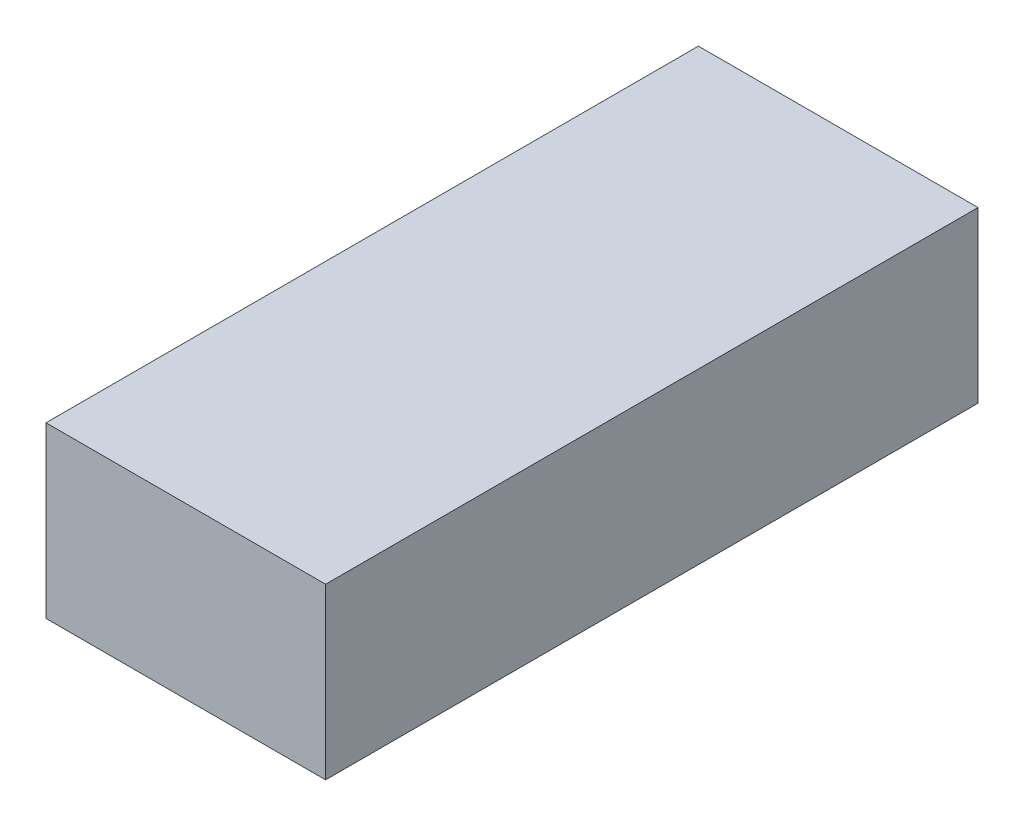
from build123d import *

# Parameters (mm, degrees)
SKETCH1_W           = 33
SKETCH1_H           = 77
BOSS_EXTRUDE1_DEPTH = 20


with BuildPart() as part:
    # Sketch1 → Boss-Extrude1 (new body)
    with BuildSketch(Plane(origin=(0, 0, 0), x_dir=(1, 0, 0), z_dir=(0, 1, 0))):
        Rectangle(SKETCH1_W, SKETCH1_H)
    extrude(amount=BOSS_EXTRUDE1_DEPTH)


solid = part.part
